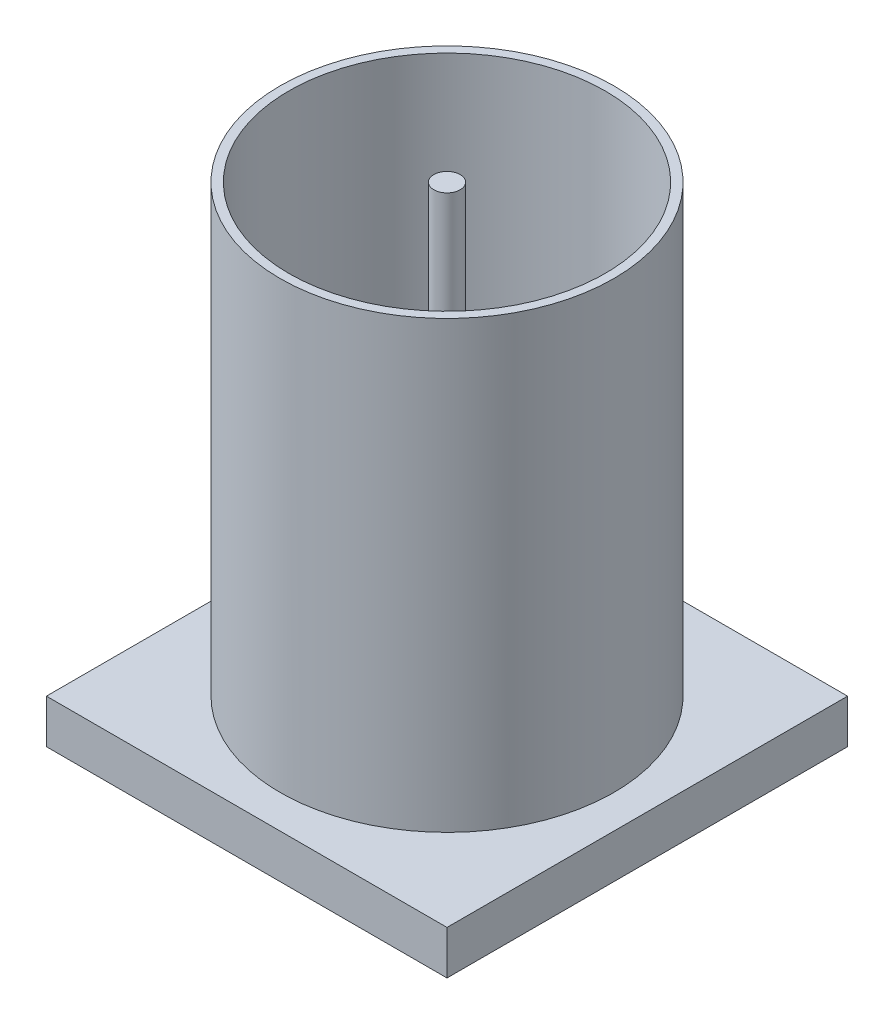
from build123d import *

# Parameters (mm, degrees)
SKETCH2_W           = 4.572
SKETCH2_H           = 4.572
BOSS_EXTRUDE1_DEPTH = 0.5
SKETCH3_R           = 1.905
BOSS_EXTRUDE2_DEPTH = 5.08
SHELL10_T           = -0.1
SKETCH7_R           = 0.15
BOSS_EXTRUDE3_DEPTH = 5.08


with BuildPart() as part:
    # Sketch2 → Boss-Extrude1 (new body)
    with BuildSketch(Plane(origin=(0, 0, 0), x_dir=(1, 0, 0), z_dir=(0, 1, 0))):
        Rectangle(SKETCH2_W, SKETCH2_H)
    extrude(amount=BOSS_EXTRUDE1_DEPTH)

    # Sketch3 → Boss-Extrude2 (add)
    with BuildSketch(Plane(origin=(0, 0.5, 0), x_dir=(1, 0, 0), z_dir=(0, 1, 0))):
        with Locations(Location((0, 0, 0), (0, 0, 90))):
            Circle(SKETCH3_R)
    extrude(amount=BOSS_EXTRUDE2_DEPTH)

    # Shell10
    shell10_openings = [part.faces().sort_by_distance(p)[0] for p in [
        (0, 5.58, 0),
    ]]
    offset(amount=SHELL10_T, openings=shell10_openings, kind=Kind.INTERSECTION)


with BuildPart() as body_2:
    # Sketch7 → Boss-Extrude3 (new body)
    with BuildSketch(Plane(origin=(0, 0.5, 0), x_dir=(1, 0, 0), z_dir=(0, 1, 0))):
        with Locations(Location((0, 0, 0), (0, 0, 270))):
            Circle(SKETCH7_R)
    extrude(amount=BOSS_EXTRUDE3_DEPTH)


solid = Compound([part.part, body_2.part])
